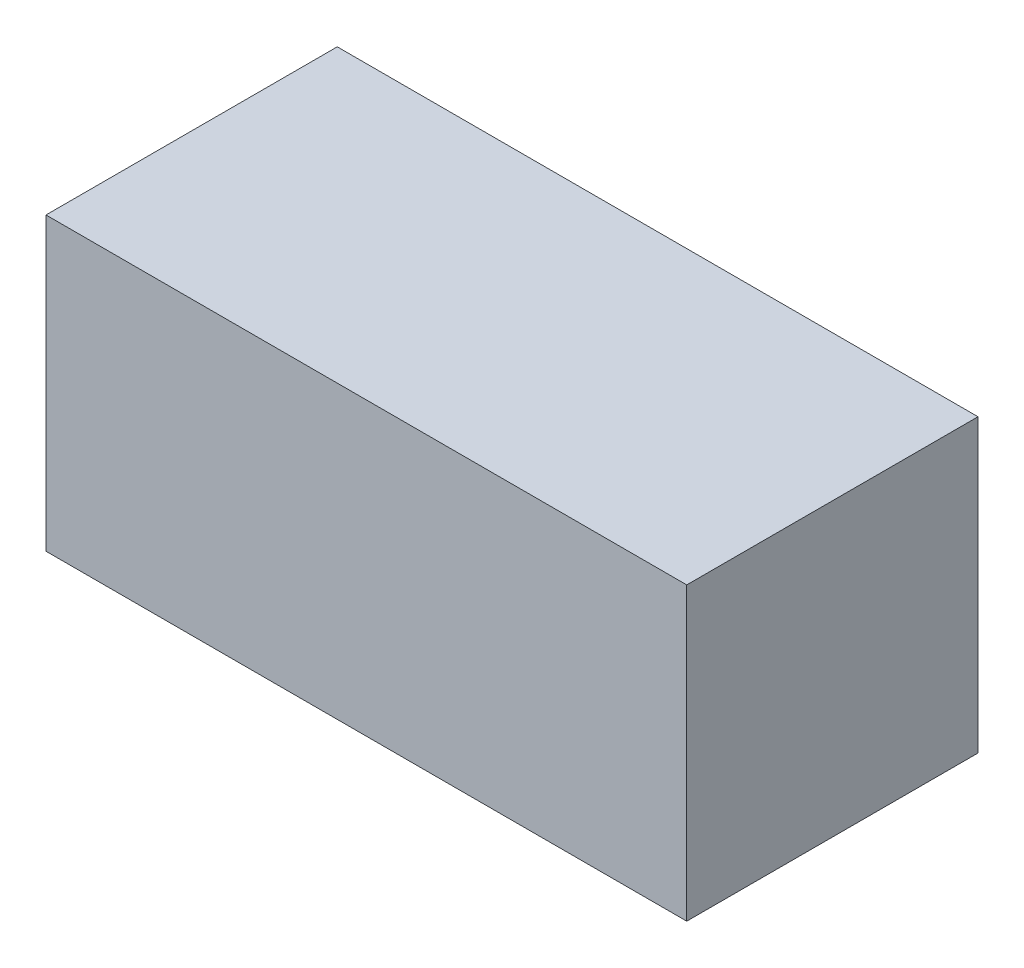
from build123d import *

# Parameters (mm, degrees)
SKETCH_1_W      = 66
SKETCH_1_H      = 30
EXTRUDE_1_DEPTH = 30


with BuildPart() as part:
    # Эскиз1 → Бобышка-Вытянуть1 (new body)
    with BuildSketch(Plane.XY):
        with Locations((77.050320868, 22.631091658)):
            Rectangle(SKETCH_1_W, SKETCH_1_H)
    extrude(amount=EXTRUDE_1_DEPTH)


solid = part.part
